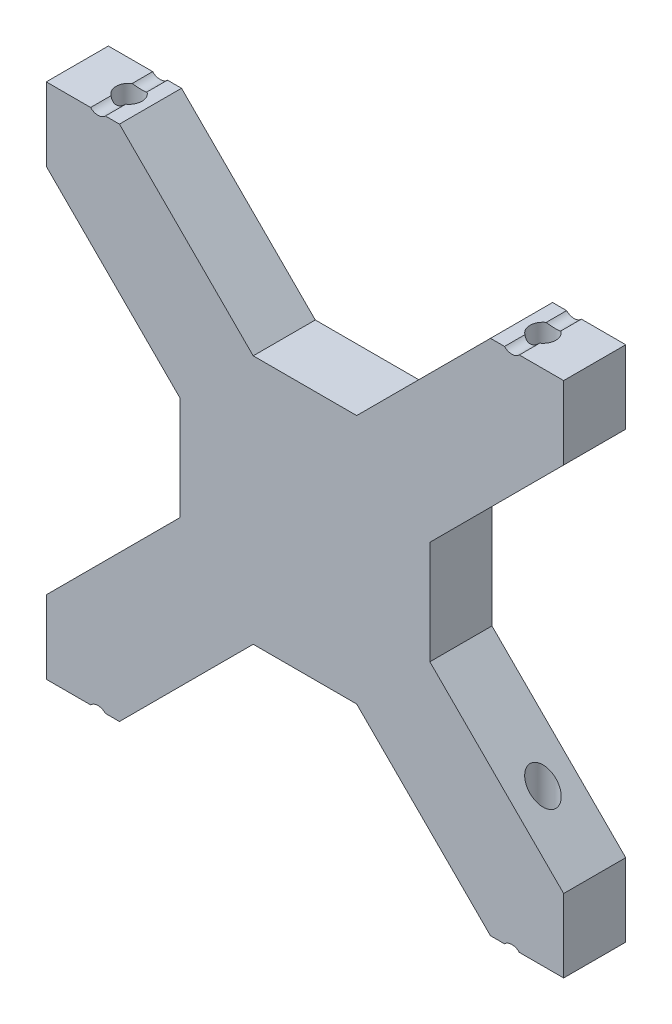
from build123d import *

# Parameters (mm, degrees)
EXTRUDE_1_DEPTH        = 6
CUT_EXTRUDE_1_DEPTH    = 42.104177289
FILLET_1_R             = 2
FILLET_1_OF_MIRROR_3_R = 2
SKETCH_3_R             = 1.25
CUT_EXTRUDE_2_DEPTH    = 59.233427122
SKETCH_4_W             = 4.242640687
SKETCH_4_H             = 50
CUT_EXTRUDE_3_DEPTH    = 39.937540248


with BuildPart() as part:
    # ｽｹｯﾁ1 → ﾎﾞｽ - 押し出し1 (new body)
    with BuildSketch(Plane.XY):
        Polygon((-32.071067812, 25), (-12.071067812, 5), (-12.071067812, -5), (-32.071067812, -25), (-17.928932188, -25), (-5, -12.071067812), (5, -12.071067812), (17.928932188, -25), (32.071067812, -25), (12.071067812, -5), (12.071067812, 5), (32.071067812, 25), (17.928932188, 25), (5, 12.071067812), (-5, 12.071067812), (-17.928932188, 25), align=None)
    extrude(amount=EXTRUDE_1_DEPTH)

    # ｽｹｯﾁ2 → ｶｯﾄ - 押し出し1 (cut, through all)
    with BuildSketch(Plane.XY.offset(6)):
        with BuildLine():
            Line((-20.714142843, 25), (-19.285857157, 25))
            ThreePointArc((-19.285857157, 25), (-20, 24.7), (-20.714142843, 25))
        make_face()
        with BuildLine():
            Line((20.714142843, 25), (19.285857157, 25))
            ThreePointArc((19.285857157, 25), (20, 24.7), (20.714142843, 25))
        make_face()
    cut_extrude_1 = extrude(amount=-CUT_EXTRUDE_1_DEPTH, mode=Mode.SUBTRACT)

    # ﾌｨﾚｯﾄ1
    fillet_1_edges = [part.edges().sort_by_distance(p)[0] for p in [
        (32.071067812, 25, 3),
        (-32.071067812, 25, 3),
    ]]
    fillet(fillet_1_edges, radius=FILLET_1_R)

    # ﾐﾗｰ3: ｶｯﾄ - 押し出し1 across plane
    add(cut_extrude_1.mirror(Plane.ZX), mode=Mode.SUBTRACT)

    # ﾌｨﾚｯﾄ1 of ﾐﾗｰ3
    fillet_1_of_mirror_3_edges = [part.edges().sort_by_distance(p)[0] for p in [
        (32.071067812, -25, 3),
        (-32.071067812, -25, 3),
    ]]
    fillet(fillet_1_of_mirror_3_edges, radius=FILLET_1_OF_MIRROR_3_R)

    # ｽｹｯﾁ3 → ｶｯﾄ - 押し出し2 (cut, through all)
    with BuildSketch(Plane(origin=(0, 25, 0), x_dir=(1, 0, 0), z_dir=(0, 1, 0))):
        with Locations(Location((-20, -3, 0), (0, 0, 304.841925036))):
            Circle(SKETCH_3_R)
        with Locations(Location((20, -3, 0), (0, 0, 304.841925036))):
            Circle(SKETCH_3_R)
    extrude(amount=-CUT_EXTRUDE_2_DEPTH, mode=Mode.SUBTRACT)

    # ｽｹｯﾁ4 → ｶｯﾄ - 押し出し3 (cut, through all)
    with BuildSketch(Plane.XY.offset(6)):
        with Locations((-27.121320344, 0)):
            Rectangle(SKETCH_4_W, SKETCH_4_H)
        with Locations((27.121320344, 0)):
            Rectangle(SKETCH_4_W, SKETCH_4_H)
    extrude(amount=-CUT_EXTRUDE_3_DEPTH, mode=Mode.SUBTRACT)


solid = part.part
